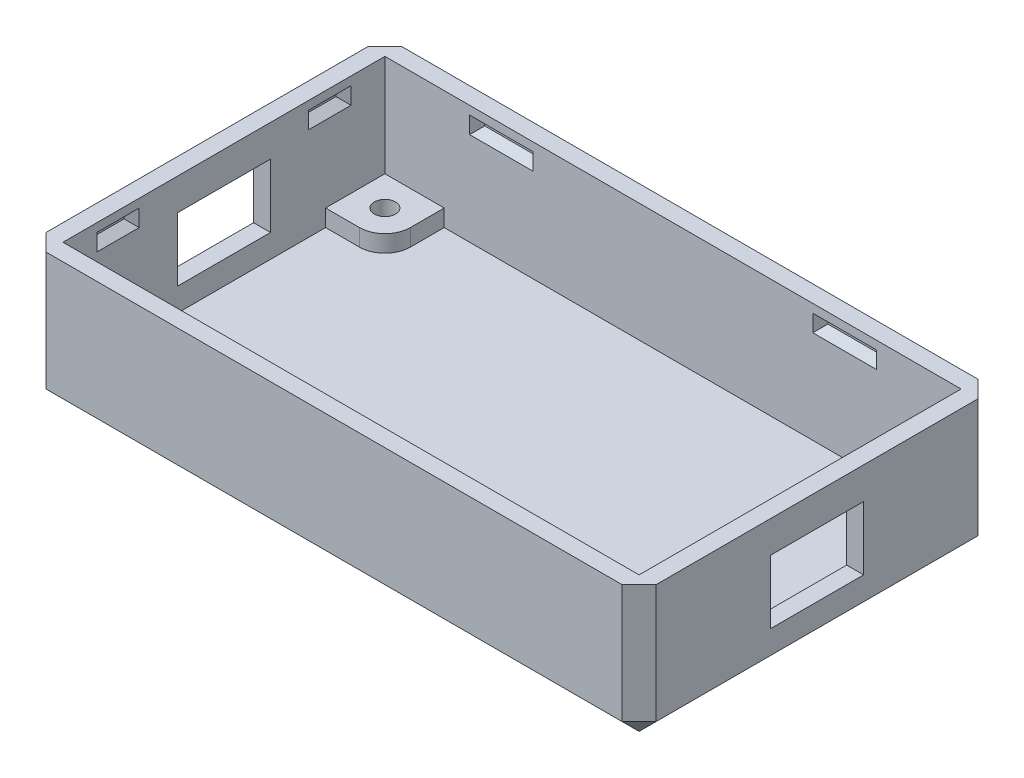
from build123d import *

# Parameters (mm, degrees)
SKETCH1_W               = 72
SKETCH1_H               = 42
SKETCH1_W_2             = 68
SKETCH1_H_2             = 38
BOSS_EXTRUDE1_DEPTH     = 2
BOSS_EXTRUDE2_START     = 2
SKETCH1_3_W             = 72
SKETCH1_3_H             = 42
SKETCH1_3_W_2           = 68
SKETCH1_3_H_2           = 38
BOSS_EXTRUDE2_DEPTH     = 14
CHAMFER1_SIZE           = 2
SKETCH2_R               = 1.25
BOSS_EXTRUDE3_DEPTH     = 2
MIRROR2_COPY_1_SKETCH_R = 1.25
MIRROR2_COPY_1_DEPTH    = 2
CUT_EXTRUDE1_DEPTH      = 1.6
MIRROR4_COPY_1_DEPTH    = 1.6
CUT_EXTRUDE2_DEPTH      = 44.965895874
CUT_EXTRUDE2_DEPTH_BACK = 44.965895874
SKETCH4_R               = 1.25
SKETCH5_W               = 7.5
SKETCH5_H               = 2
CUT_EXTRUDE3_DEPTH      = 1
CUT_EXTRUDE3_DRAFT      = -38
MIRROR5_COPY_1_SKETCH_W = 7.5
MIRROR5_COPY_1_SKETCH_H = 2
MIRROR5_COPY_1_DEPTH    = 1
MIRROR5_COPY_1_DRAFT    = -38
MIRROR8_COPY_1_SKETCH_W = 7.5
MIRROR8_COPY_1_SKETCH_H = 2
MIRROR8_COPY_1_DEPTH    = 1
MIRROR8_COPY_1_DRAFT    = -38
MIRROR8_COPY_2_SKETCH_W = 7.5
MIRROR8_COPY_2_SKETCH_H = 2
MIRROR8_COPY_2_DEPTH    = 1
MIRROR8_COPY_2_DRAFT    = -38
SKETCH6_W               = 5
SKETCH6_H               = 2
CUT_EXTRUDE4_DEPTH      = 1
CUT_EXTRUDE4_DRAFT      = -38
MIRROR6_COPY_1_SKETCH_W = 5
MIRROR6_COPY_1_SKETCH_H = 2
MIRROR6_COPY_1_DEPTH    = 1
MIRROR6_COPY_1_DRAFT    = -38
MIRROR7_COPY_1_SKETCH_W = 5
MIRROR7_COPY_1_SKETCH_H = 2
MIRROR7_COPY_1_DEPTH    = 1
MIRROR7_COPY_1_DRAFT    = -38
MIRROR7_COPY_2_SKETCH_W = 5
MIRROR7_COPY_2_SKETCH_H = 2
MIRROR7_COPY_2_DEPTH    = 1
MIRROR7_COPY_2_DRAFT    = -38
SKETCH7_W               = 11
SKETCH7_H               = 7.5
CUT_EXTRUDE5_DEPTH      = 77.68767828


with BuildPart() as part:
    # Sketch1 → Boss-Extrude1 (new body)
    # profile 1 of 2: a face of its own
    with BuildSketch(Plane(origin=(0, 0, 0), x_dir=(1, 0, 0), z_dir=(0, 1, 0))):
        Rectangle(SKETCH1_W, SKETCH1_H)
        Rectangle(SKETCH1_W_2, SKETCH1_H_2, mode=Mode.SUBTRACT)
    # profile 2 of 2: a face of its own
    with BuildSketch(Plane(origin=(0, 0, 0), x_dir=(1, 0, 0), z_dir=(0, 1, 0))):
        Rectangle(SKETCH1_W_2, SKETCH1_H_2)
    extrude(amount=BOSS_EXTRUDE1_DEPTH)

    # Sketch1<3> → Boss-Extrude2 (add)
    with BuildSketch(Plane(origin=(0, 0, 0), x_dir=(1, 0, 0), z_dir=(0, 1, 0)).offset(BOSS_EXTRUDE2_START)):
        Rectangle(SKETCH1_3_W, SKETCH1_3_H)
        Rectangle(SKETCH1_3_W_2, SKETCH1_3_H_2, mode=Mode.SUBTRACT)
    extrude(amount=BOSS_EXTRUDE2_DEPTH)

    # Chamfer1
    chamfer1_edges = [part.edges().sort_by_distance(p)[0] for p in [
        (0, 0, -21),
        (36, 0, 0),
        (0, 0, 21),
        (-36, 0, 0),
        (-36, 8, -21),
        (36, 8, -21),
        (36, 8, 21),
        (-36, 8, 21),
    ]]
    chamfer(chamfer1_edges, length=CHAMFER1_SIZE)

    # Sketch2 → Boss-Extrude3 (add)
    with BuildSketch(Plane(origin=(0, 2, 0), x_dir=(1, 0, 0), z_dir=(0, 1, 0))):
        with BuildLine():
            Line((-34, 12), (-30, 12))
            ThreePointArc((-30, 12), (-27.878679656, 12.878679656), (-27, 15))
            Line((-27, 15), (-27, 19))
            Line((-27, 19), (-34, 19))
            Line((-34, 19), (-34, 12))
        make_face()
        with Locations(Location((-30.5, 15.5, 0), (0, 0, 270))):
            Circle(SKETCH2_R, mode=Mode.SUBTRACT)
    boss_extrude3 = extrude(amount=BOSS_EXTRUDE3_DEPTH)

    # Mirror1: Boss-Extrude3 across plane
    add(boss_extrude3.mirror(Plane.XY))

    # Mirror2: Boss-Extrude3 across plane
    add(boss_extrude3.mirror(Plane(origin=(0, 0, 0), x_dir=(0, 0, 1), z_dir=(1, 0, 0))))

    # Mirror2 copy 1 sketch → Mirror2 copy 1 (add)
    with BuildSketch(Plane(origin=(0, 2, 0), x_dir=(-1, 0, 0), z_dir=(0, 1, 0))):
        with BuildLine():
            Line((-34, 12), (-30, 12))
            ThreePointArc((-30, 12), (-27.878679656, 12.878679656), (-27, 15))
            Line((-27, 15), (-27, 19))
            Line((-27, 19), (-34, 19))
            Line((-34, 19), (-34, 12))
        make_face()
        with Locations(Location((-30.5, 15.5, 0), (0, 0, 270))):
            Circle(MIRROR2_COPY_1_SKETCH_R, mode=Mode.SUBTRACT)
    extrude(amount=MIRROR2_COPY_1_DEPTH)

    # Sketch3 → Cut-Extrude1 (cut)
    with BuildSketch(Plane.XZ):
        Polygon((-31.799038106, 17.75), (-29.200961894, 17.75), (-27.901923789, 15.5), (-29.200961894, 13.25), (-31.799038106, 13.25), (-33.098076211, 15.5), align=None)
    cut_extrude1 = extrude(amount=-CUT_EXTRUDE1_DEPTH, mode=Mode.SUBTRACT)

    # Mirror3: Cut-Extrude1 across plane
    add(cut_extrude1.mirror(Plane.XY), mode=Mode.SUBTRACT)

    # Mirror4: Cut-Extrude1 across plane
    add(cut_extrude1.mirror(Plane(origin=(0, 0, 0), x_dir=(0, 0, 1), z_dir=(1, 0, 0))), mode=Mode.SUBTRACT)

    # Mirror4 copy 1 sketch → Mirror4 copy 1 (cut)
    with BuildSketch(Plane(origin=(0, 0, 0), x_dir=(-1, 0, 0), z_dir=(0, -1, 0))):
        Polygon((-31.799038106, 17.75), (-29.200961894, 17.75), (-27.901923789, 15.5), (-29.200961894, 13.25), (-31.799038106, 13.25), (-33.098076211, 15.5), align=None)
    extrude(amount=-MIRROR4_COPY_1_DEPTH, mode=Mode.SUBTRACT)

    # Sketch4 → Cut-Extrude2 (cut, two sides: drawn at the far end of the back side and taken through both)
    with BuildSketch(Plane(origin=(0, 2, 0), x_dir=(1, 0, 0), z_dir=(0, 1, 0)).offset(-CUT_EXTRUDE2_DEPTH_BACK)):
        with Locations(Location((30.5, -15.5, 0), (0, 0, 90))):
            Circle(SKETCH4_R)
        with Locations(Location((30.5, 15.5, 0), (0, 0, 270))):
            Circle(SKETCH4_R)
        with Locations(Location((-30.5, 15.5, 0), (0, 0, 270))):
            Circle(SKETCH4_R)
        with Locations(Location((-30.5, -15.5, 0), (0, 0, 90))):
            Circle(SKETCH4_R)
    extrude(amount=CUT_EXTRUDE2_DEPTH + CUT_EXTRUDE2_DEPTH_BACK, mode=Mode.SUBTRACT)


with BuildPart() as cut_extrude3_tool:
    # Sketch5 → Cut-Extrude3 (with draft: the straight prism first)
    with BuildSketch(Plane(origin=(0, 0, 19), x_dir=(-1, 0, 0), z_dir=(0, 0, -1))):
        with Locations((-20.25, 14)):
            Rectangle(SKETCH5_W, SKETCH5_H)
    extrude(amount=-CUT_EXTRUDE3_DEPTH)
    # Cut-Extrude3: the draft: its side faces are tilted about the plane it starts from
    cut_extrude3_sides = [cut_extrude3_tool.faces().sort_by_distance(p)[0] for p in [
        (24, 14, 19.5),
        (20.25, 13, 19.5),
        (16.5, 14, 19.5),
        (20.25, 15, 19.5),
    ]]
    draft(cut_extrude3_sides, Plane(origin=(0, 0, 19), x_dir=(-1, 0, 0), z_dir=(0, 0, -1)), CUT_EXTRUDE3_DRAFT)


with BuildPart() as part_1:
    add(part.part)

    # Cut-Extrude3: cut by cut_extrude3_tool
    add(cut_extrude3_tool.part, mode=Mode.SUBTRACT)


with BuildPart() as mirror5_copy_1_tool:
    # Mirror5 copy 1 sketch → Mirror5 copy 1 (with draft: the straight prism first)
    with BuildSketch(Plane(origin=(0, 0, -19), x_dir=(-1, 0, 0), z_dir=(0, 0, 1))):
        with Locations((-20.25, -14)):
            Rectangle(MIRROR5_COPY_1_SKETCH_W, MIRROR5_COPY_1_SKETCH_H)
    extrude(amount=-MIRROR5_COPY_1_DEPTH)
    # Mirror5 copy 1: the draft: its side faces are tilted about the plane it starts from
    mirror5_copy_1_sides = [mirror5_copy_1_tool.faces().sort_by_distance(p)[0] for p in [
        (24, 14, -19.5),
        (20.25, 13, -19.5),
        (16.5, 14, -19.5),
        (20.25, 15, -19.5),
    ]]
    draft(mirror5_copy_1_sides, Plane(origin=(0, 0, -19), x_dir=(-1, 0, 0), z_dir=(0, 0, 1)), MIRROR5_COPY_1_DRAFT)


with BuildPart() as part_2:
    add(part_1.part)

    # Mirror5 copy 1: cut by mirror5_copy_1_tool
    add(mirror5_copy_1_tool.part, mode=Mode.SUBTRACT)


with BuildPart() as mirror8_copy_1_tool:
    # Mirror8 copy 1 sketch → Mirror8 copy 1 (with draft: the straight prism first)
    with BuildSketch(Plane(origin=(0, 0, 19), x_dir=(1, 0, 0), z_dir=(0, 0, -1))):
        with Locations((-20.25, -14)):
            Rectangle(MIRROR8_COPY_1_SKETCH_W, MIRROR8_COPY_1_SKETCH_H)
    extrude(amount=-MIRROR8_COPY_1_DEPTH)
    # Mirror8 copy 1: the draft: its side faces are tilted about the plane it starts from
    mirror8_copy_1_sides = [mirror8_copy_1_tool.faces().sort_by_distance(p)[0] for p in [
        (-24, 14, 19.5),
        (-20.25, 13, 19.5),
        (-16.5, 14, 19.5),
        (-20.25, 15, 19.5),
    ]]
    draft(mirror8_copy_1_sides, Plane(origin=(0, 0, 19), x_dir=(1, 0, 0), z_dir=(0, 0, -1)), MIRROR8_COPY_1_DRAFT)


with BuildPart() as part_3:
    add(part_2.part)

    # Mirror8 copy 1: cut by mirror8_copy_1_tool
    add(mirror8_copy_1_tool.part, mode=Mode.SUBTRACT)


with BuildPart() as mirror8_copy_2_tool:
    # Mirror8 copy 2 sketch → Mirror8 copy 2 (with draft: the straight prism first)
    with BuildSketch(Plane.XY.offset(-19)):
        with Locations((-20.25, 14)):
            Rectangle(MIRROR8_COPY_2_SKETCH_W, MIRROR8_COPY_2_SKETCH_H)
    extrude(amount=-MIRROR8_COPY_2_DEPTH)
    # Mirror8 copy 2: the draft: its side faces are tilted about the plane it starts from
    mirror8_copy_2_sides = [mirror8_copy_2_tool.faces().sort_by_distance(p)[0] for p in [
        (-24, 14, -19.5),
        (-20.25, 13, -19.5),
        (-16.5, 14, -19.5),
        (-20.25, 15, -19.5),
    ]]
    draft(mirror8_copy_2_sides, Plane.XY.offset(-19), MIRROR8_COPY_2_DRAFT)


with BuildPart() as part_4:
    add(part_3.part)

    # Mirror8 copy 2: cut by mirror8_copy_2_tool
    add(mirror8_copy_2_tool.part, mode=Mode.SUBTRACT)


with BuildPart() as cut_extrude4_tool:
    # Sketch6 → Cut-Extrude4 (with draft: the straight prism first)
    with BuildSketch(Plane(origin=(-34, 0, 0), x_dir=(0, 0, -1), z_dir=(1, 0, 0))):
        with Locations((-12.5, 14)):
            Rectangle(SKETCH6_W, SKETCH6_H)
    extrude(amount=-CUT_EXTRUDE4_DEPTH)
    # Cut-Extrude4: the draft: its side faces are tilted about the plane it starts from
    cut_extrude4_sides = [cut_extrude4_tool.faces().sort_by_distance(p)[0] for p in [
        (-34.5, 14, 15),
        (-34.5, 13, 12.5),
        (-34.5, 14, 10),
        (-34.5, 15, 12.5),
    ]]
    draft(cut_extrude4_sides, Plane(origin=(-34, 0, 0), x_dir=(0, 0, -1), z_dir=(1, 0, 0)), CUT_EXTRUDE4_DRAFT)


with BuildPart() as part_5:
    add(part_4.part)

    # Cut-Extrude4: cut by cut_extrude4_tool
    add(cut_extrude4_tool.part, mode=Mode.SUBTRACT)


with BuildPart() as mirror6_copy_1_tool:
    # Mirror6 copy 1 sketch → Mirror6 copy 1 (with draft: the straight prism first)
    with BuildSketch(Plane(origin=(34, 0, 0), x_dir=(0, 0, -1), z_dir=(-1, 0, 0))):
        with Locations((-12.5, -14)):
            Rectangle(MIRROR6_COPY_1_SKETCH_W, MIRROR6_COPY_1_SKETCH_H)
    extrude(amount=-MIRROR6_COPY_1_DEPTH)
    # Mirror6 copy 1: the draft: its side faces are tilted about the plane it starts from
    mirror6_copy_1_sides = [mirror6_copy_1_tool.faces().sort_by_distance(p)[0] for p in [
        (34.5, 14, 15),
        (34.5, 13, 12.5),
        (34.5, 14, 10),
        (34.5, 15, 12.5),
    ]]
    draft(mirror6_copy_1_sides, Plane(origin=(34, 0, 0), x_dir=(0, 0, -1), z_dir=(-1, 0, 0)), MIRROR6_COPY_1_DRAFT)


with BuildPart() as part_6:
    add(part_5.part)

    # Mirror6 copy 1: cut by mirror6_copy_1_tool
    add(mirror6_copy_1_tool.part, mode=Mode.SUBTRACT)


with BuildPart() as mirror7_copy_1_tool:
    # Mirror7 copy 1 sketch → Mirror7 copy 1 (with draft: the straight prism first)
    with BuildSketch(Plane(origin=(-34, 0, 0), x_dir=(0, 0, 1), z_dir=(1, 0, 0))):
        with Locations((-12.5, -14)):
            Rectangle(MIRROR7_COPY_1_SKETCH_W, MIRROR7_COPY_1_SKETCH_H)
    extrude(amount=-MIRROR7_COPY_1_DEPTH)
    # Mirror7 copy 1: the draft: its side faces are tilted about the plane it starts from
    mirror7_copy_1_sides = [mirror7_copy_1_tool.faces().sort_by_distance(p)[0] for p in [
        (-34.5, 14, -15),
        (-34.5, 13, -12.5),
        (-34.5, 14, -10),
        (-34.5, 15, -12.5),
    ]]
    draft(mirror7_copy_1_sides, Plane(origin=(-34, 0, 0), x_dir=(0, 0, 1), z_dir=(1, 0, 0)), MIRROR7_COPY_1_DRAFT)


with BuildPart() as part_7:
    add(part_6.part)

    # Mirror7 copy 1: cut by mirror7_copy_1_tool
    add(mirror7_copy_1_tool.part, mode=Mode.SUBTRACT)


with BuildPart() as mirror7_copy_2_tool:
    # Mirror7 copy 2 sketch → Mirror7 copy 2 (with draft: the straight prism first)
    with BuildSketch(Plane.ZY.offset(-34)):
        with Locations((-12.5, 14)):
            Rectangle(MIRROR7_COPY_2_SKETCH_W, MIRROR7_COPY_2_SKETCH_H)
    extrude(amount=-MIRROR7_COPY_2_DEPTH)
    # Mirror7 copy 2: the draft: its side faces are tilted about the plane it starts from
    mirror7_copy_2_sides = [mirror7_copy_2_tool.faces().sort_by_distance(p)[0] for p in [
        (34.5, 14, -15),
        (34.5, 13, -12.5),
        (34.5, 14, -10),
        (34.5, 15, -12.5),
    ]]
    draft(mirror7_copy_2_sides, Plane.ZY.offset(-34), MIRROR7_COPY_2_DRAFT)


with BuildPart() as part_8:
    add(part_7.part)

    # Mirror7 copy 2: cut by mirror7_copy_2_tool
    add(mirror7_copy_2_tool.part, mode=Mode.SUBTRACT)

    # Sketch7 → Cut-Extrude5 (cut, through all)
    with BuildSketch(Plane(origin=(36, 0, 0), x_dir=(0, 0, -1), z_dir=(1, 0, 0))):
        with Locations((0, 8.5)):
            Rectangle(SKETCH7_W, SKETCH7_H)
    extrude(amount=-CUT_EXTRUDE5_DEPTH, mode=Mode.SUBTRACT)


solid = part_8.part
